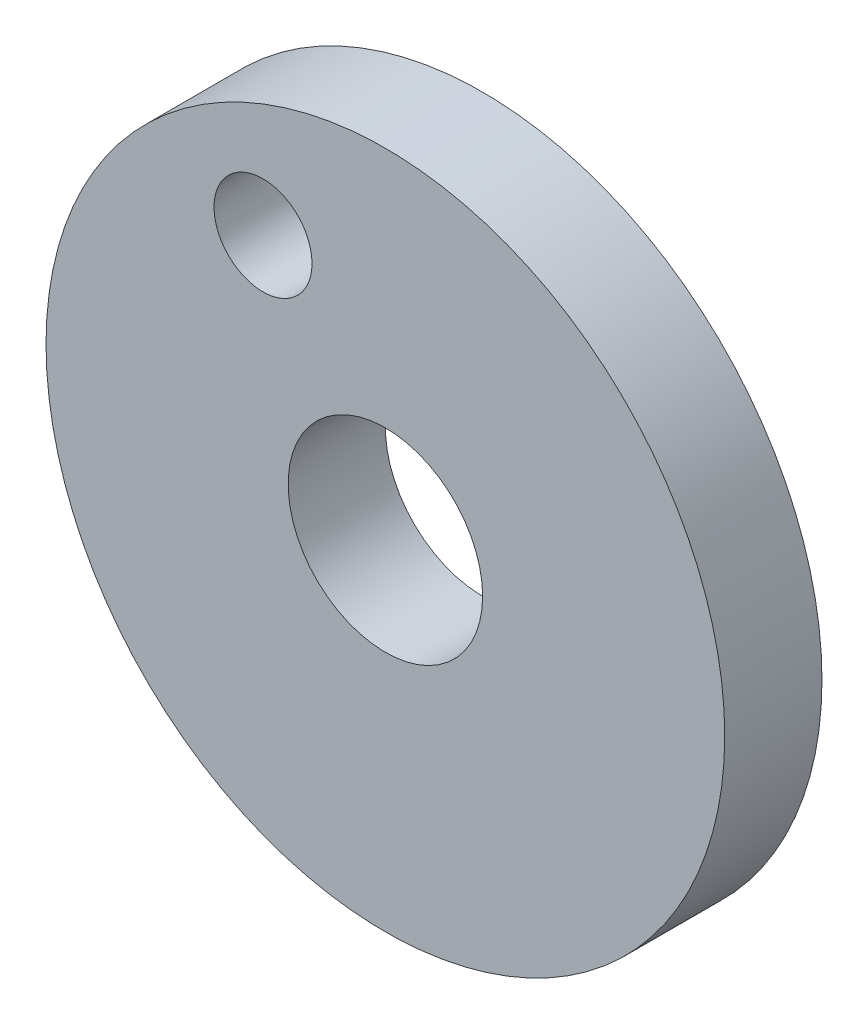
from build123d import *

# Parameters (mm, degrees)
SKETCH_1_R      = 34.9
SKETCH_1_R_2    = 10
SKETCH_1_R_3    = 5.039955202
EXTRUDE_1_DEPTH = 10


with BuildPart() as part:
    # ｽｹｯﾁ1 → ﾎﾞｽ - 押し出し1 (new body)
    with BuildSketch(Plane.XY):
        Circle(SKETCH_1_R)
        Circle(SKETCH_1_R_2, mode=Mode.SUBTRACT)
        with Locations((-12.584738316, 20.849452224)):
            Circle(SKETCH_1_R_3, mode=Mode.SUBTRACT)
    extrude(amount=EXTRUDE_1_DEPTH)


solid = part.part
